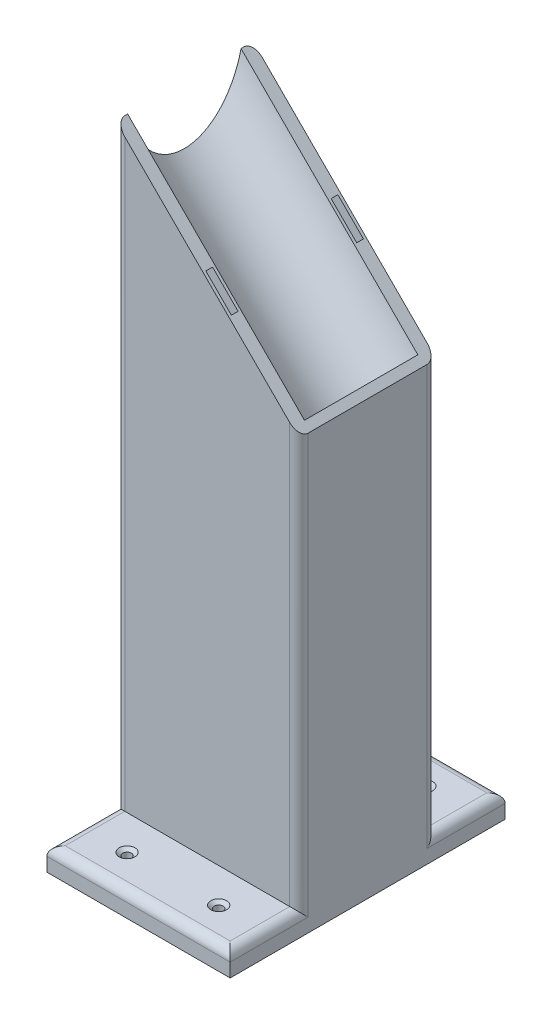
from build123d import *

# Parameters (mm, degrees)
SKETCH1_W                                         = 50.8
SKETCH1_H                                         = 76.2
BOSS_EXTRUDE1_DEPTH                               = 6.35
SKETCH2_W                                         = 50.8
SKETCH2_H                                         = 38.1
BOSS_EXTRUDE2_DEPTH                               = 171.6066
CUT_EXTRUDE1_DEPTH                                = 183.535025619
CUT_EXTRUDE1_DEPTH_BACK                           = 183.535025619
BOSS_EXTRUDE3_REACH                               = 237.296
SKETCH20_W                                        = 38.1
SKETCH20_H                                        = 2.54
BOSS_EXTRUDE4_REACH                               = 129.523
CSK_FOR_2_FLAT_HEAD_MACHINE_SCREW_100_D           = 2.4384
CSK_FOR_2_FLAT_HEAD_MACHINE_SCREW_100_CSINK_D     = 4.3688
CSK_FOR_2_FLAT_HEAD_MACHINE_SCREW_100_CSINK_ANGLE = 100
FILLET1_R                                         = 2.54
FILLET2_R                                         = 2.54
SKETCH29_W                                        = 1.860730234
SKETCH29_H                                        = 10
CUT_EXTRUDE2_DEPTH                                = 30
CUT_EXTRUDE3_REACH                                = 232.917
CUT_EXTRUDE3_END_RADIUS                           = 19.51
SKETCH30_W                                        = 43.463948775
SKETCH30_H                                        = 25.418064868


with BuildPart() as part:
    # Sketch1 → Boss-Extrude1 (new body)
    with BuildSketch(Plane(origin=(0, 0, 0), x_dir=(1, 0, 0), z_dir=(0, 1, 0))):
        with Locations((-132.195454545, 0)):
            Rectangle(SKETCH1_W, SKETCH1_H)
    extrude(amount=BOSS_EXTRUDE1_DEPTH)

    # Sketch2 → Boss-Extrude2 (add)
    with BuildSketch(Plane(origin=(0, 6.35, 0), x_dir=(1, 0, 0), z_dir=(0, 1, 0))):
        with Locations((-132.195454545, 0)):
            Rectangle(SKETCH2_W, SKETCH2_H)
    extrude(amount=BOSS_EXTRUDE2_DEPTH)

    # Sketch19 → Cut-Extrude1 (cut, two sides: drawn at the far end of the back side and taken through both)
    with BuildSketch(Plane(origin=(-167.776027273, 167.776027273, 0), x_dir=(-0.7071067811865488, -0.7071067811865462, 0), z_dir=(0.7071067811865462, -0.7071067811865488, 0)).offset(-CUT_EXTRUDE1_DEPTH_BACK)):
        with BuildLine():
            Line((-14.397504024, 16.51), (-14.397504024, -16.51))
            ThreePointArc((-14.397504024, -16.51), (2.112495976, 0), (-14.397504024, 16.51))
        make_face()
    extrude(amount=CUT_EXTRUDE1_DEPTH + CUT_EXTRUDE1_DEPTH_BACK, mode=Mode.SUBTRACT)

    # SurfaceCut1
    split(bisect_by=Plane(origin=(6.588470279, 6.588470279, 0), x_dir=(0, 0, 1), z_dir=(-0.7071067811865488, -0.7071067811865464, 0)), keep=Keep.TOP)

    # Sketch20 → Boss-Extrude3 (add, up to next)
    with BuildSketch(Plane(origin=(6.588470279, 6.588470279, 0), x_dir=(0, 0, -1), z_dir=(0.7071067811865487, 0.7071067811865465, 0)), mode=Mode.PRIVATE) as boss_extrude3_sk1:
        with Locations((0, 161.619084242)):
            Rectangle(SKETCH20_W, SKETCH20_H)
    boss_extrude3_tool1 = extrude(boss_extrude3_sk1.sketch, amount=-BOSS_EXTRUDE3_REACH, mode=Mode.PRIVATE) - part.part
    add(boss_extrude3_tool1.solids().sort_by_distance((-107.69348, 120.870421, 0))[0])

    # Boss-Extrude4: up to this face of the body (flat: up to its plane)
    boss_extrude4_end = Plane(part.part.faces().sort_by_distance((-106.795454545, 52.426789341, 0))[0])
    # Sketch22 → Boss-Extrude4 (add, up to the picked face)
    with BuildSketch(Plane(origin=(-113.383924824, 113.383924824, 0), x_dir=(0, 0, -1), z_dir=(0.7071067811865465, -0.7071067811865486, 0)), mode=Mode.PRIVATE) as boss_extrude4_sk1:
        with BuildLine():
            Line((-15.709032434, 9.317504024), (15.709032434, 9.317504024))
            ThreePointArc((15.709032434, 9.317504024), (0, -6.39152841), (-15.709032434, 9.317504024))
        make_face()
    boss_extrude4_tool1 = split(extrude(boss_extrude4_sk1.sketch, amount=BOSS_EXTRUDE4_REACH, mode=Mode.PRIVATE), bisect_by=boss_extrude4_end, keep=Keep.BOTH, mode=Mode.PRIVATE)
    add(boss_extrude4_tool1.solids().sort_by(Axis((-111.509821, 115.258029, 0), (0.7071067811865465, -0.7071067811865486, 0)))[0])

    # CSK for #2 Flat Head Machine Screw (100)1 (through all)
    with Locations(Plane(origin=(0, 6.35, 0), x_dir=(1, 0, 0), z_dir=(0, 1, 0))):
        with Locations((-144.895454545, -28.575), (-119.495454545, -28.575)):
            csk_for_2_flat_head_machine_screw_100 = CounterSinkHole(CSK_FOR_2_FLAT_HEAD_MACHINE_SCREW_100_D / 2, CSK_FOR_2_FLAT_HEAD_MACHINE_SCREW_100_CSINK_D / 2, counter_sink_angle=CSK_FOR_2_FLAT_HEAD_MACHINE_SCREW_100_CSINK_ANGLE)

    # Mirror1: CSK for #2 Flat Head Machine Screw (100)1 across plane
    add(csk_for_2_flat_head_machine_screw_100.mirror(Plane.XY), mode=Mode.SUBTRACT)

    # Fillet1
    fillet1_edges = [part.edges().sort_by_distance(p)[0] for p in [
        (-157.595454545, 88.561197552, 19.05),
        (-106.795454545, 63.161197552, 19.05),
        (-106.795454545, 63.161197552, -19.05),
        (-157.595454545, 88.561197552, -19.05),
    ]]
    fillet(fillet1_edges, radius=FILLET1_R)

    # Fillet2
    fillet2_edges = [part.edges().sort_by_distance(p)[0] for p in [
        (-157.595454545, 6.35, -27.305),
        (-132.195454545, 6.35, -38.1),
        (-106.795454545, 6.35, -27.305),
        (-157.595454545, 6.35, 27.305),
        (-132.195454545, 6.35, 38.1),
        (-106.795454545, 6.35, 27.305),
    ]]
    fillet(fillet2_edges, radius=FILLET2_R)

    # Sketch29 → Cut-Extrude2 (cut)
    with BuildSketch(Plane(origin=(6.588470279, 6.588470279, 0), x_dir=(0, 0, -1), z_dir=(0.7071067811865487, 0.7071067811865465, 0))):
        with Locations((17.36598973, 192.889084242)):
            Rectangle(SKETCH29_W, SKETCH29_H)
        with Locations((-17.36598973, 192.889084242)):
            Rectangle(SKETCH29_W, SKETCH29_H)
    extrude(amount=-CUT_EXTRUDE2_DEPTH, mode=Mode.SUBTRACT)

    # Cut-Extrude3: up to this cylinder (the profile starts outside it)
    cut_extrude3_end = Plane(origin=(-59.656167273, 80.017312727, 0), z_dir=(0.7071067811865462, -0.7071067811865488, 0)) * Cylinder(CUT_EXTRUDE3_END_RADIUS, 505.854, mode=Mode.PRIVATE)
    # Sketch30 → Cut-Extrude3 (cut, up to the surface)
    with BuildSketch(Plane(origin=(0, 6.35, 0), x_dir=(1, 0, 0), z_dir=(0, 1, 0)), mode=Mode.PRIVATE) as cut_extrude3_sk1:
        with Locations((-133.323480158, 0)):
            Rectangle(SKETCH30_W, SKETCH30_H)
    cut_extrude3_tool1 = extrude(cut_extrude3_sk1.sketch, amount=CUT_EXTRUDE3_REACH, mode=Mode.PRIVATE) - cut_extrude3_end
    add(cut_extrude3_tool1.solids().sort_by_distance((-133.32348, 6.35, 0))[0], mode=Mode.SUBTRACT)


solid = part.part
